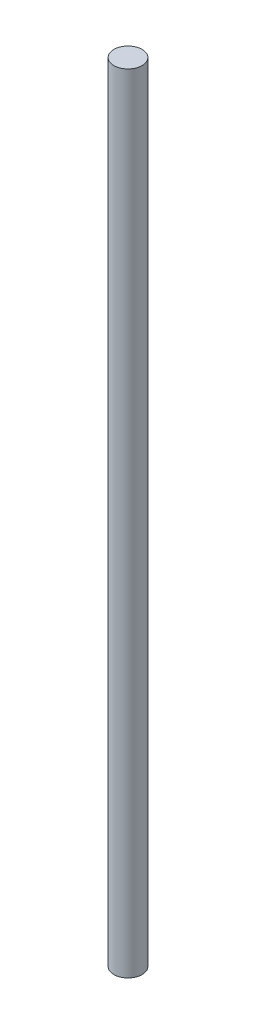
from build123d import *

# Parameters (mm, degrees)
SKETCH1_R           = 5
BOSS_EXTRUDE1_DEPTH = 280


with BuildPart() as part:
    # Sketch1 → Boss-Extrude1 (new body)
    with BuildSketch(Plane(origin=(0, 0, 0), x_dir=(1, 0, 0), z_dir=(0, 1, 0))):
        with Locations(Location((0, 0, 0), (0, 0, 270))):
            Circle(SKETCH1_R)
    extrude(amount=BOSS_EXTRUDE1_DEPTH)


solid = part.part
